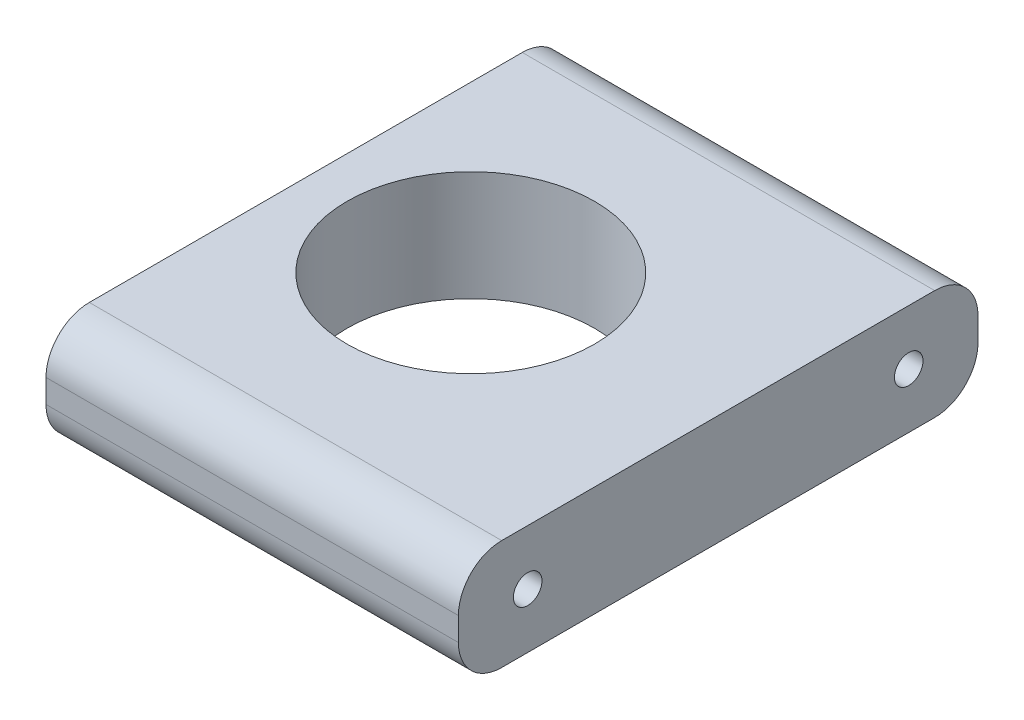
from build123d import *

# Parameters (mm, degrees)
SKETCH2_W             = 23.81
SKETCH2_H             = 10.7125
SKETCH2_W_2           = 19.0525
SKETCH2_W_3           = 11.11
SKETCH2_W_4           = 9.39
SKETCH2_W_5           = 6.35
SKETCH2_W_6           = 1.725
SKETCH2_W_7           = 1.585
SKETCH2_W_8           = 6.3525
BOSS_EXTRUDE1_DEPTH   = 12.7
M4X0_7_TAPPED_HOLE1_D = 3.3
FILLET1_R             = 5


with BuildPart() as part:
    # Sketch2 → Boss-Extrude1 (new body)
    with BuildSketch(Plane(origin=(0, 0, 0), x_dir=(1, 0, 0), z_dir=(0, 1, 0))):
        with Locations((24.605, 66.53125)):
            Rectangle(SKETCH2_W, SKETCH2_H)
        with Locations((3.17375, 66.53125)):
            Rectangle(SKETCH2_W_2, SKETCH2_H)
        with BuildLine():
            Line((0, 22.6), (1.585, 22.6))
            Line((1.585, 22.6), (3.31, 22.6))
            Line((3.31, 22.6), (12.7, 22.6))
            Line((12.7, 22.6), (12.7, 27.6))
            ThreePointArc((12.7, 27.6), (-1.5875, 41.8875), (12.7, 56.175))
            Line((12.7, 56.175), (12.7, 61.175))
            Line((12.7, 61.175), (-6.3525, 61.175))
            Line((-6.3525, 61.175), (-6.3525, 22.6))
            Line((-6.3525, 22.6), (0, 22.6))
        make_face()
        with BuildLine():
            Line((12.7, 22.6), (23.81, 22.6))
            Line((23.81, 22.6), (30.16, 22.6))
            Line((30.16, 22.6), (36.51, 22.6))
            Line((36.51, 22.6), (36.51, 61.175))
            Line((36.51, 61.175), (12.7, 61.175))
            Line((12.7, 61.175), (12.7, 56.175))
            ThreePointArc((12.7, 56.175), (22.802788136, 51.990288136), (26.9875, 41.8875))
            ThreePointArc((26.9875, 41.8875), (22.802788136, 31.784711864), (12.7, 27.6))
            Line((12.7, 27.6), (12.7, 22.6))
        make_face()
        with Locations((18.255, 17.24375)):
            Rectangle(SKETCH2_W_3, SKETCH2_H)
        with Locations((8.005, 17.24375)):
            Rectangle(SKETCH2_W_4, SKETCH2_H)
        with Locations((26.985, 17.24375)):
            Rectangle(SKETCH2_W_5, SKETCH2_H)
        with Locations((33.335, 17.24375)):
            Rectangle(SKETCH2_W_5, SKETCH2_H)
        with Locations((2.4475, 17.24375)):
            Rectangle(SKETCH2_W_6, SKETCH2_H)
        with Locations((0.7925, 17.24375)):
            Rectangle(SKETCH2_W_7, SKETCH2_H)
        with Locations((-3.17625, 17.24375)):
            Rectangle(SKETCH2_W_8, SKETCH2_H)
        Polygon((36.51, 22.6), (36.51, 11.8875), (41.2725, 11.8875), (41.2725, 71.8875), (36.51, 71.8875), (36.51, 61.175), align=None)
    extrude(amount=BOSS_EXTRUDE1_DEPTH)

    # M4x0.7 Tapped Hole1 (through all)
    with Locations(Plane(origin=(41.2725, 0, 0), x_dir=(0, 0, -1), z_dir=(1, 0, 0))):
        with Locations((63.8875, 6.35), (19.8875, 6.35)):
            Hole(M4X0_7_TAPPED_HOLE1_D / 2)

    # Fillet1
    fillet1_edges = [part.edges().sort_by_distance(p)[0] for p in [
        (17.46, 0, -11.8875),
        (17.46, 12.7, -11.8875),
        (17.46, 12.7, -71.8875),
        (17.46, 0, -71.8875),
    ]]
    fillet(fillet1_edges, radius=FILLET1_R)


solid = part.part
